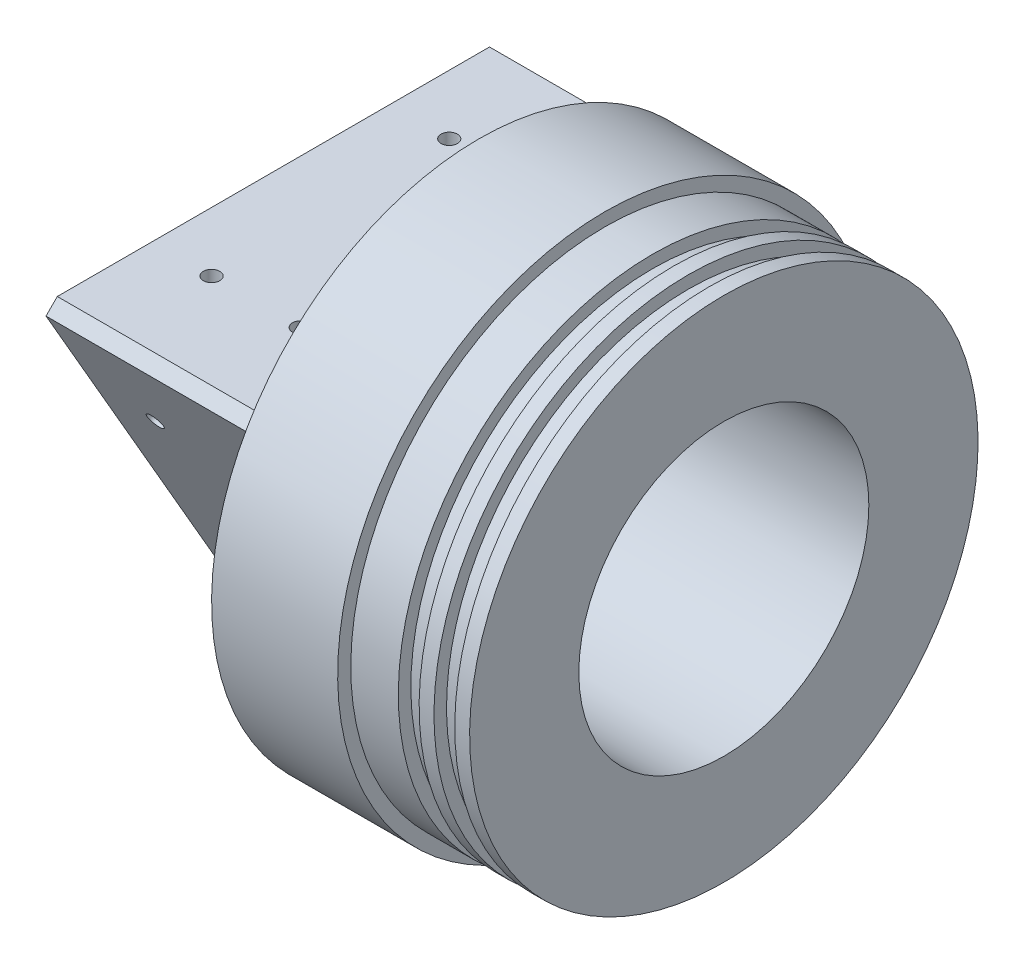
from build123d import *
from OCP.BRepFilletAPI import BRepFilletAPI_MakeChamfer

# Parameters (mm, degrees)
BOSS_EXTRUDE1_DEPTH            = 22.225
SKETCH4_R                      = 22.5
CUT_EXTRUDE2_DEPTH             = 39
CHAMFER1_SIZE                  = 1.27
CHAMFER1_SIZE2                 = 0.733234842
SKETCH5_R                      = 20
CUT_EXTRUDE3_DEPTH             = 22.225
F_6_32_TAPPED_HOLE2_AT_2_COUNT = 2
F_6_32_TAPPED_HOLE2_AT_2_PITCH = 19.05
F_6_32_TAPPED_HOLE2_AT_3_COUNT = 2
F_6_32_TAPPED_HOLE2_AT_3_PITCH = 54.254423783
F_6_32_TAPPED_HOLE2_AT_4_COUNT = 2
F_6_32_TAPPED_HOLE2_AT_4_PITCH = 50.8
CIRPATTERN1_COUNT              = 3
SKETCH9_R                      = 31
CUT_EXTRUDE5_DEPTH             = 46
CUT_EXTRUDE6_REACH             = 97.461
SKETCH10_R                     = 17.5
CHAMFER2_SIZE                  = 3.81
CHAMFER2_SIZE2                 = 2.789113577
FILLET4_R                      = 1.27


with BuildPart() as part:
    # Sketch1 → Boss-Extrude1 (new, symmetric)
    with BuildSketch(Plane(origin=(0, 0, 0), x_dir=(0, 0, -1), z_dir=(1, 0, 0))):
        Polygon((-49.493351826, 28.575), (49.493351826, 28.575), (0, -57.15), align=None)
    extrude(amount=BOSS_EXTRUDE1_DEPTH, both=True)

    # Sketch4 → Cut-Extrude2 (cut)
    with BuildSketch(Plane.ZY.offset(22.225)):
        Circle(SKETCH4_R)
    extrude(amount=-CUT_EXTRUDE2_DEPTH, mode=Mode.SUBTRACT)

    # Chamfer1
    chamfer1_edges = [part.edges().sort_by_distance(p)[0] for p in [
        (-22.225, 0, -22.5),
    ]]
    chamfer1_side = [part.faces().sort_by_distance(p)[0] for p in [
        (-22.225, 27.265528995, 0),
    ]]
    chamfer(chamfer1_edges, length=CHAMFER1_SIZE, length2=CHAMFER1_SIZE2, reference=chamfer1_side[0])

    # Sketch5 → Cut-Extrude3 (cut)
    with BuildSketch(Plane(origin=(0, 0, 0), x_dir=(0, 0, -1), z_dir=(1, 0, 0))):
        with Locations(Location((0, 0, 0), (0, 0, 180))):
            Circle(SKETCH5_R)
    extrude(amount=CUT_EXTRUDE3_DEPTH, mode=Mode.SUBTRACT)

    # Sketch6 → Revolve1 (revolve)
    with BuildSketch(Plane.XY):
        Polygon((22.225, 0), (22.225, 57.15), (49.175, 57.15), (49.175, 54.3433), (59.335, 54.3433), (59.335, 51.6636), (63.78, 51.6636), (63.78, 54.3433), (66.955, 54.3433), (66.955, 51.6636), (71.4, 51.6636), (71.4, 54.3433), (74.575, 54.3433), (74.575, 0), align=None)
    revolve(axis=Axis((74.575, 0, 0), (-1, 0, 0)))

    # Sketch8 → #6-32 Tapped Hole2 (revolve, cut)
    with BuildSketch(Plane(origin=(-9.525, 28.575, -25.4), x_dir=(0, 0, 1), z_dir=(1, 0, 0))):
        Polygon((0, 0), (0, 13.51269403), (1.35255, 12.7), (1.35255, 5.588), (1.7526, 5.588), (1.7526, 0), align=None)
    f_6_32_tapped_hole2 = revolve(axis=Axis((-9.525, 34.925, -25.4), (0, -1, 0)), mode=Mode.SUBTRACT)

    # #6-32 Tapped Hole2 at 2: #6-32 Tapped Hole2 ×2
    with Locations(*[(i * F_6_32_TAPPED_HOLE2_AT_2_PITCH, 0, 0) for i in range(1, F_6_32_TAPPED_HOLE2_AT_2_COUNT)]):
        add(f_6_32_tapped_hole2, mode=Mode.SUBTRACT)

    # #6-32 Tapped Hole2 at 3: #6-32 Tapped Hole2 ×2
    with Locations(*[Vector(0.35112344158839176, 0, 0.9363291775690445) * (i * F_6_32_TAPPED_HOLE2_AT_3_PITCH) for i in range(1, F_6_32_TAPPED_HOLE2_AT_3_COUNT)]):
        add(f_6_32_tapped_hole2, mode=Mode.SUBTRACT)

    # #6-32 Tapped Hole2 at 4: #6-32 Tapped Hole2 ×2
    with Locations(*[(0, 0, i * F_6_32_TAPPED_HOLE2_AT_4_PITCH) for i in range(1, F_6_32_TAPPED_HOLE2_AT_4_COUNT)]):
        add(f_6_32_tapped_hole2, mode=Mode.SUBTRACT)

    # CirPattern1: #6-32 Tapped Hole2 ×3 about axis
    cirpattern1_axis = Axis((0, 0, 0), (1, 0, 0))
    for i in range(1, CIRPATTERN1_COUNT):
        add(f_6_32_tapped_hole2.rotate(cirpattern1_axis, i * 360 / CIRPATTERN1_COUNT), mode=Mode.SUBTRACT)

    # CirPattern1 copy 1 sketch → CirPattern1 copy 1 (revolve, cut)
    with BuildSketch(Plane(origin=(9.525, 7.709545256, 37.446675913), x_dir=(0, -0.8660254037844387, -0.4999999999999998), z_dir=(1, 0, 0))):
        Polygon((0, 0), (0, 13.51269403), (1.35255, 12.7), (1.35255, 5.588), (1.7526, 5.588), (1.7526, 0), align=None)
    revolve(axis=Axis((9.525, 4.534545256, 42.945937227), (0, 0.4999999999999998, -0.8660254037844387)), mode=Mode.SUBTRACT)

    # CirPattern1 copy 2 sketch → CirPattern1 copy 2 (revolve, cut)
    with BuildSketch(Plane(origin=(9.525, -36.284545256, -12.046675913), x_dir=(0, 0.8660254037844384, -0.5000000000000004), z_dir=(1, 0, 0))):
        Polygon((0, 0), (0, 13.51269403), (1.35255, 12.7), (1.35255, 5.588), (1.7526, 5.588), (1.7526, 0), align=None)
    revolve(axis=Axis((9.525, -39.459545256, -17.545937227), (0, 0.5000000000000004, 0.8660254037844384)), mode=Mode.SUBTRACT)

    # CirPattern1 copy 3 sketch → CirPattern1 copy 3 (revolve, cut)
    with BuildSketch(Plane(origin=(9.525, -36.284545256, 12.046675913), x_dir=(0, -0.8660254037844387, -0.4999999999999998), z_dir=(1, 0, 0))):
        Polygon((0, 0), (0, 13.51269403), (1.35255, 12.7), (1.35255, 5.588), (1.7526, 5.588), (1.7526, 0), align=None)
    revolve(axis=Axis((9.525, -39.459545256, 17.545937227), (0, 0.4999999999999998, -0.8660254037844387)), mode=Mode.SUBTRACT)

    # CirPattern1 copy 4 sketch → CirPattern1 copy 4 (revolve, cut)
    with BuildSketch(Plane(origin=(9.525, 7.709545256, -37.446675913), x_dir=(0, 0.8660254037844384, -0.5000000000000004), z_dir=(1, 0, 0))):
        Polygon((0, 0), (0, 13.51269403), (1.35255, 12.7), (1.35255, 5.588), (1.7526, 5.588), (1.7526, 0), align=None)
    revolve(axis=Axis((9.525, 4.534545256, -42.945937227), (0, 0.5000000000000004, 0.8660254037844384)), mode=Mode.SUBTRACT)

    # CirPattern1 copy 5 sketch → CirPattern1 copy 5 (revolve, cut)
    with BuildSketch(Plane(origin=(-9.525, -36.284545256, 12.046675913), x_dir=(0, -0.8660254037844387, -0.4999999999999998), z_dir=(1, 0, 0))):
        Polygon((0, 0), (0, 13.51269403), (1.35255, 12.7), (1.35255, 5.588), (1.7526, 5.588), (1.7526, 0), align=None)
    revolve(axis=Axis((-9.525, -39.459545256, 17.545937227), (0, 0.4999999999999998, -0.8660254037844387)), mode=Mode.SUBTRACT)

    # CirPattern1 copy 6 sketch → CirPattern1 copy 6 (revolve, cut)
    with BuildSketch(Plane(origin=(-9.525, 7.709545256, -37.446675913), x_dir=(0, 0.8660254037844384, -0.5000000000000004), z_dir=(1, 0, 0))):
        Polygon((0, 0), (0, 13.51269403), (1.35255, 12.7), (1.35255, 5.588), (1.7526, 5.588), (1.7526, 0), align=None)
    revolve(axis=Axis((-9.525, 4.534545256, -42.945937227), (0, 0.5000000000000004, 0.8660254037844384)), mode=Mode.SUBTRACT)

    # Sketch9 → Cut-Extrude5 (cut)
    with BuildSketch(Plane(origin=(74.575, 0, 0), x_dir=(0, 0, -1), z_dir=(1, 0, 0))):
        with Locations(Location((0, 0, 0), (0, 0, 90))):
            Circle(SKETCH9_R)
    extrude(amount=-CUT_EXTRUDE5_DEPTH, mode=Mode.SUBTRACT)

    # Sketch10 → Cut-Extrude6 (cut, up to next)
    with BuildSketch(Plane(origin=(28.575, 0, 0), x_dir=(0, 0, -1), z_dir=(1, 0, 0)), mode=Mode.PRIVATE) as cut_extrude6_sk1:
        with Locations(Location((0, 0, 0), (0, 0, 90))):
            Circle(SKETCH10_R)
    cut_extrude6_tool1 = extrude(cut_extrude6_sk1.sketch, amount=-CUT_EXTRUDE6_REACH, mode=Mode.PRIVATE) & part.part
    add(cut_extrude6_tool1.solids().sort_by_distance((28.575, 0, 0))[0], mode=Mode.SUBTRACT)

    # Chamfer2: one chamfer whose edges measure the first distance from different faces: ONE call of the kernel's chamfer builder (chamfer() names one face for all edges)
    chamfer2_edges_1 = [part.edges().sort_by_distance(p)[0] for p in [
        (0, 28.575, 49.493351826),
    ]]
    chamfer2_side_1 = [part.faces().sort_by_distance(p)[0] for p in [
        (0, 28.575, 0),
    ]]
    chamfer2_edges_2 = [part.edges().sort_by_distance(p)[0] for p in [
        (0, 28.575, -49.493351826),
    ]]
    chamfer2_side_2 = [part.faces().sort_by_distance(p)[0] for p in [
        (0, -14.2875, -24.746675913),
    ]]
    chamfer2_edges_3 = [part.edges().sort_by_distance(p)[0] for p in [
        (0, -57.15, 0),
    ]]
    chamfer2_side_3 = [part.faces().sort_by_distance(p)[0] for p in [
        (0, -14.2875, 24.746675913),
    ]]
    chamfer2 = BRepFilletAPI_MakeChamfer(part.part.solid().wrapped)
    for e in chamfer2_edges_1:
        chamfer2.Add(CHAMFER2_SIZE, CHAMFER2_SIZE2, e.wrapped, chamfer2_side_1[0].wrapped)  # the first distance lies on this face
    for e in chamfer2_edges_2:
        chamfer2.Add(CHAMFER2_SIZE, CHAMFER2_SIZE2, e.wrapped, chamfer2_side_2[0].wrapped)  # the first distance lies on this face
    for e in chamfer2_edges_3:
        chamfer2.Add(CHAMFER2_SIZE, CHAMFER2_SIZE2, e.wrapped, chamfer2_side_3[0].wrapped)  # the first distance lies on this face
    add(Compound.cast(chamfer2.Shape()), mode=Mode.REPLACE)

    # Fillet4
    fillet4_edges = [part.edges().sort_by_distance(p)[0] for p in [
        (22.225, -14.729556788, -24.491454307),
        (22.225, -13.845443212, 25.001897519),
        (22.225, 28.575, -0.510443212),
        (22.225, -54.2925, 0.255221606),
        (22.225, 26.925221606, -47.146295038),
        (22.225, 27.367278394, 46.891073432),
    ]]
    fillet(fillet4_edges, radius=FILLET4_R)


solid = part.part
